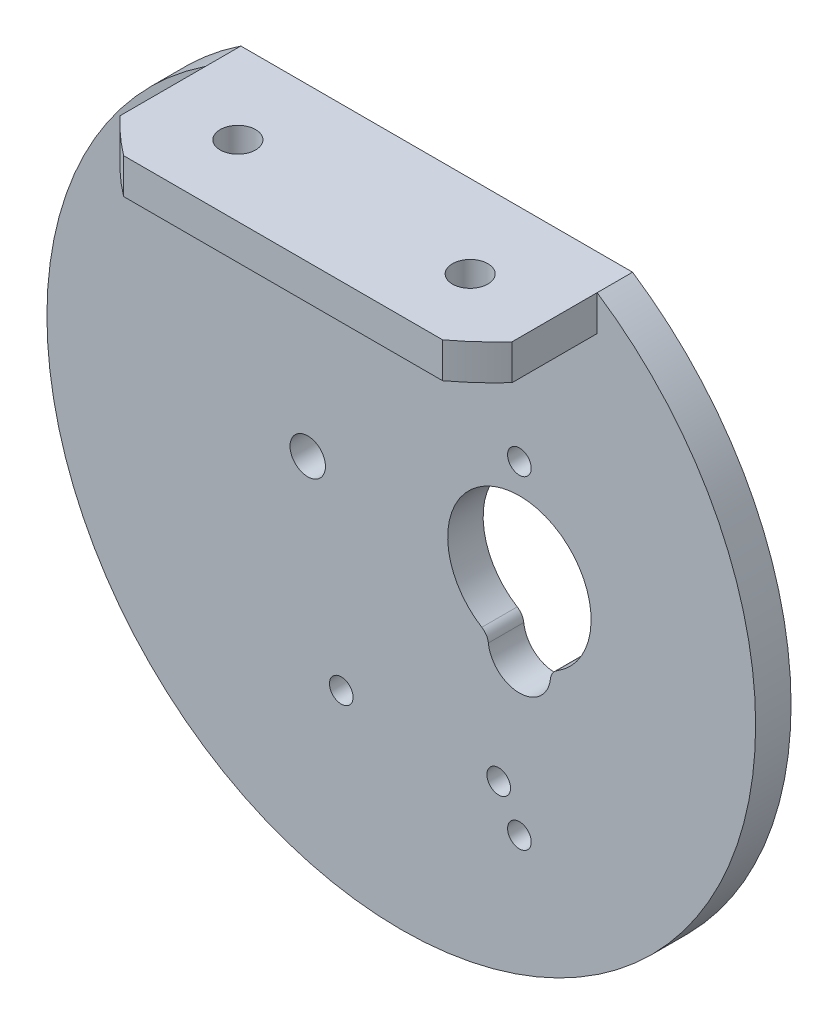
from build123d import *

# Parameters (mm, degrees)
BOSS_EXTRU_1_DEPTH      = 3
BOSS_EXTRU_2_START      = -3
ESQUISSE2_W             = 33.166247904
ESQUISSE2_H             = 3
BOSS_EXTRU_2_DEPTH      = 10
ENL_V_MAT_EXTRU_1_DEPTH = 10
ESQUISSE4_R             = 1.5
ENL_V_MAT_EXTRU_2_DEPTH = 10
ESQUISSE5_R             = 1
ENL_V_MAT_EXTRU_3_DEPTH = 44.588989435
ENL_V_MAT_EXTRU_4_DEPTH = 45.373415465
ESQUISSE7_R             = 1.5
ENL_V_MAT_EXTRU_5_DEPTH = 45.373415465
ESQUISSE8_R             = 1
ENL_V_MAT_EXTRU_6_DEPTH = 3


with BuildPart() as part:
    # Esquisse1 → Boss.-Extru.1 (new body)
    with BuildSketch(Plane.XY):
        with BuildLine():
            Line((16.583123952, 25), (-16.583123952, 25))
            ThreePointArc((-16.583123952, 25), (-14.186371655, -26.433820369), (30, 0))
            ThreePointArc((30, 0), (26.433820369, 14.186371655), (16.583123952, 25))
        make_face()
    extrude(amount=BOSS_EXTRU_1_DEPTH)

    # Esquisse2 → Boss.-Extru.2 (add)
    with BuildSketch(Plane(origin=(0, 0, 0), x_dir=(-1, 0, 0), z_dir=(0, 0, -1)).offset(BOSS_EXTRU_2_START)):
        with Locations((0, 23.5)):
            Rectangle(ESQUISSE2_W, ESQUISSE2_H)
    extrude(amount=-BOSS_EXTRU_2_DEPTH)

    # Esquisse3 → Enlèv. mat.-Extru.1 (cut)
    with BuildSketch(Plane(origin=(0, 25, 0), x_dir=(1, 0, 0), z_dir=(0, 1, 0))):
        with BuildLine():
            Line((13.498123952, -13), (16.583123952, -13))
            Line((16.583123952, -13), (16.583123952, -10.204860243))
            ThreePointArc((16.583123952, -10.204860243), (15.105407222, -11.673931516), (13.498123952, -13))
        make_face()
        with BuildLine():
            Line((-16.583123952, -10.208951902), (-16.583123952, -13))
            Line((-16.583123952, -13), (-13.501876048, -13))
            ThreePointArc((-13.501876048, -13), (-15.107102171, -11.675795147), (-16.583123952, -10.208951902))
        make_face()
    extrude(amount=-ENL_V_MAT_EXTRU_1_DEPTH, mode=Mode.SUBTRACT)

    # Esquisse4 → Enlèv. mat.-Extru.2 (cut)
    with BuildSketch(Plane.XZ.offset(-22)):
        with Locations(Location((-9.833123952, 7, 0), (0, 0, 270))):
            Circle(ESQUISSE4_R)
        with Locations(Location((9.833123952, 7, 0), (0, 0, 90))):
            Circle(ESQUISSE4_R)
    extrude(amount=-ENL_V_MAT_EXTRU_2_DEPTH, mode=Mode.SUBTRACT)

    # Esquisse5 → Enlèv. mat.-Extru.3 (cut, through all)
    with BuildSketch(Plane.XY.offset(3)):
        with Locations((10, -18.075)):
            Circle(ESQUISSE5_R)
        with Locations((10, 9.325)):
            Circle(ESQUISSE5_R)
    extrude(amount=-ENL_V_MAT_EXTRU_3_DEPTH, mode=Mode.SUBTRACT)

    # Esquisse6 → Enlèv. mat.-Extru.4 (cut, through all)
    with BuildSketch(Plane(origin=(0, 0, 0), x_dir=(-1, 0, 0), z_dir=(0, 0, -1))):
        with BuildLine():
            ThreePointArc((-12.628743756, -5.29279902), (-12.804806967, -4.79174357), (-13.182765939, -4.418645952))
            ThreePointArc((-13.182765939, -4.418645952), (-10, 6.82), (-6.817234061, -4.418645952))
            ThreePointArc((-6.817234061, -4.418645952), (-7.195193033, -4.79174357), (-7.371256244, -5.29279902))
            ThreePointArc((-7.371256244, -5.29279902), (-10, -7.645), (-12.628743756, -5.29279902))
        make_face()
    extrude(amount=-ENL_V_MAT_EXTRU_4_DEPTH, mode=Mode.SUBTRACT)

    # Esquisse7 → Enlèv. mat.-Extru.5 (cut, through all)
    with BuildSketch(Plane(origin=(0, 0, 0), x_dir=(-1, 0, 0), z_dir=(0, 0, -1))):
        with Locations((7.92, 0.75)):
            Circle(ESQUISSE7_R)
    extrude(amount=-ENL_V_MAT_EXTRU_5_DEPTH, mode=Mode.SUBTRACT)

    # Esquisse8 → Enlèv. mat.-Extru.6 (cut)
    with BuildSketch(Plane(origin=(0, 0, 0), x_dir=(-1, 0, 0), z_dir=(0, 0, -1))):
        with Locations((-8.25, -15)):
            Circle(ESQUISSE8_R)
        with Locations((5.08, -15)):
            Circle(ESQUISSE8_R)
    extrude(amount=-ENL_V_MAT_EXTRU_6_DEPTH, mode=Mode.SUBTRACT)


solid = part.part
